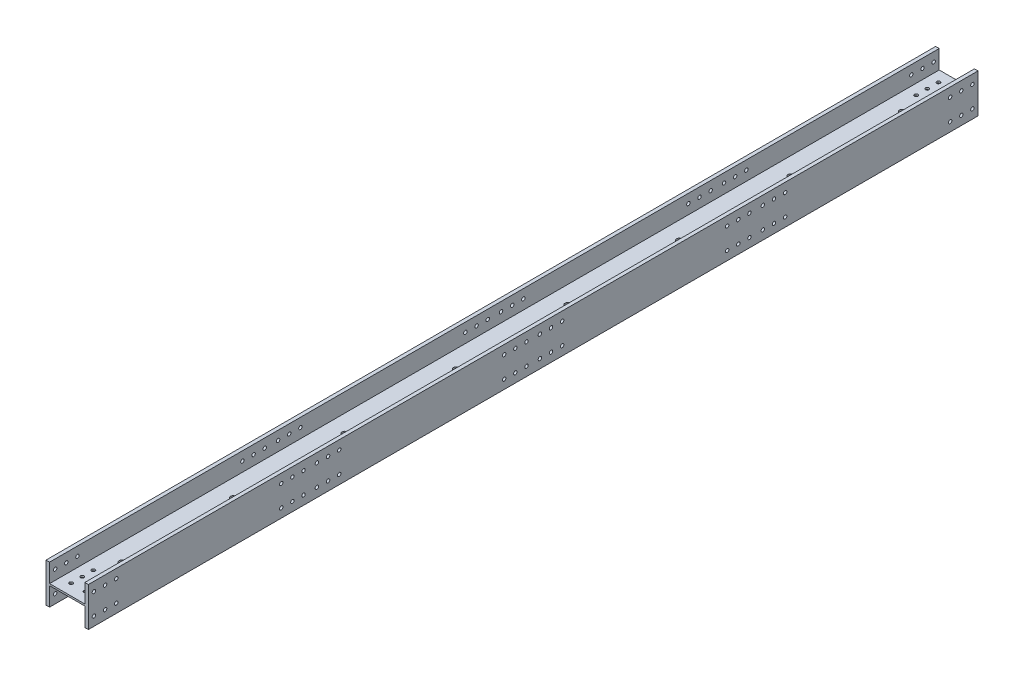
from build123d import *

# Parameters (mm, degrees)
EXTRUDE_1_DEPTH     = 3990
SKETCH_2_R          = 15.5
CUT_EXTRUDE_2_DEPTH = 4012.873003972
SKETCH_3_R          = 15.5
SKETCH_3_R_2        = 25
CUT_EXTRUDE_3_DEPTH = 3999.710917283


with BuildPart() as part:
    # 草图1 → 拉伸1 (new body)
    with BuildSketch(Plane.XY):
        Polygon((-158, 175), (-190, 175), (-190, -175), (-158, -175), (-158, -8), (158, -8), (158, -175), (190, -175), (190, 175), (158, 175), (158, 8), (-158, 8), align=None)
    extrude(amount=EXTRUDE_1_DEPTH)

    # 草图2 → 拉伸2 (cut, through all)
    with BuildSketch(Plane(origin=(190, 0, 0), x_dir=(0, 0, -1), z_dir=(1, 0, 0))):
        with Locations(Location((-3940, 95, 0), (0, 0, 90))):
            Circle(SKETCH_2_R)
        with Locations(Location((-3840, 95, 0), (0, 0, 90))):
            Circle(SKETCH_2_R)
        with Locations(Location((-3740, 95, 0), (0, 0, 90))):
            Circle(SKETCH_2_R)
        with Locations(Location((-3940, -95, 0), (0, 0, 90))):
            Circle(SKETCH_2_R)
        with Locations(Location((-3840, -95, 0), (0, 0, 90))):
            Circle(SKETCH_2_R)
        with Locations(Location((-3740, -95, 0), (0, 0, 90))):
            Circle(SKETCH_2_R)
        with Locations(Location((-2260, 95, 0), (0, 0, 90))):
            Circle(SKETCH_2_R)
        with Locations(Location((-2160, 95, 0), (0, 0, 90))):
            Circle(SKETCH_2_R)
        with Locations(Location((-2060, 95, 0), (0, 0, 90))):
            Circle(SKETCH_2_R)
        with Locations(Location((-2260, -95, 0), (0, 0, 90))):
            Circle(SKETCH_2_R)
        with Locations(Location((-2160, -95, 0), (0, 0, 90))):
            Circle(SKETCH_2_R)
        with Locations(Location((-2060, -95, 0), (0, 0, 90))):
            Circle(SKETCH_2_R)
        with Locations(Location((-1740, 95, 0), (0, 0, 90))):
            Circle(SKETCH_2_R)
        with Locations(Location((-1940, 95, 0), (0, 0, 90))):
            Circle(SKETCH_2_R)
        with Locations(Location((-1840, 95, 0), (0, 0, 90))):
            Circle(SKETCH_2_R)
        with Locations(Location((-1940, -95, 0), (0, 0, 90))):
            Circle(SKETCH_2_R)
        with Locations(Location((-1840, -95, 0), (0, 0, 90))):
            Circle(SKETCH_2_R)
        with Locations(Location((-1740, -95, 0), (0, 0, 90))):
            Circle(SKETCH_2_R)
        with Locations(Location((-260, 95, 0), (0, 0, 90))):
            Circle(SKETCH_2_R)
        with Locations(Location((-60, 95, 0), (0, 0, 90))):
            Circle(SKETCH_2_R)
        with Locations(Location((-60, -95, 0), (0, 0, 90))):
            Circle(SKETCH_2_R)
        with Locations(Location((-160, 95, 0), (0, 0, 90))):
            Circle(SKETCH_2_R)
        with Locations(Location((-160, -95, 0), (0, 0, 90))):
            Circle(SKETCH_2_R)
        with Locations(Location((-260, -95, 0), (0, 0, 90))):
            Circle(SKETCH_2_R)
    extrude(amount=-CUT_EXTRUDE_2_DEPTH, mode=Mode.SUBTRACT)

    # 草图3 → 拉伸3 (cut, through all)
    with BuildSketch(Plane(origin=(0, 8, 0), x_dir=(1, 0, 0), z_dir=(0, 1, 0))):
        with Locations(Location((-65, -3890, 0), (0, 0, 270))):
            Circle(SKETCH_3_R)
        with Locations(Location((65, -3890, 0), (0, 0, 270))):
            Circle(SKETCH_3_R)
        with Locations(Location((-65, -3790, 0), (0, 0, 270))):
            Circle(SKETCH_3_R)
        with Locations(Location((65, -3790, 0), (0, 0, 270))):
            Circle(SKETCH_3_R)
        with Locations(Location((-65, -3690, 0), (0, 0, 270))):
            Circle(SKETCH_3_R)
        with Locations(Location((65, -3690, 0), (0, 0, 270))):
            Circle(SKETCH_3_R)
        with Locations(Location((0, -500, 0), (0, 0, 270))):
            Circle(SKETCH_3_R_2)
        with Locations(Location((0, -1500, 0), (0, 0, 270))):
            Circle(SKETCH_3_R_2)
        with Locations(Location((0, -2500, 0), (0, 0, 270))):
            Circle(SKETCH_3_R_2)
        with Locations(Location((0, -3500, 0), (0, 0, 270))):
            Circle(SKETCH_3_R_2)
    extrude(amount=-CUT_EXTRUDE_3_DEPTH, mode=Mode.SUBTRACT)

    # 镜向1: part across plane


with BuildPart() as part_1:
    add(part.part)
    add(part.part.mirror(Plane.XY))


solid = part_1.part
